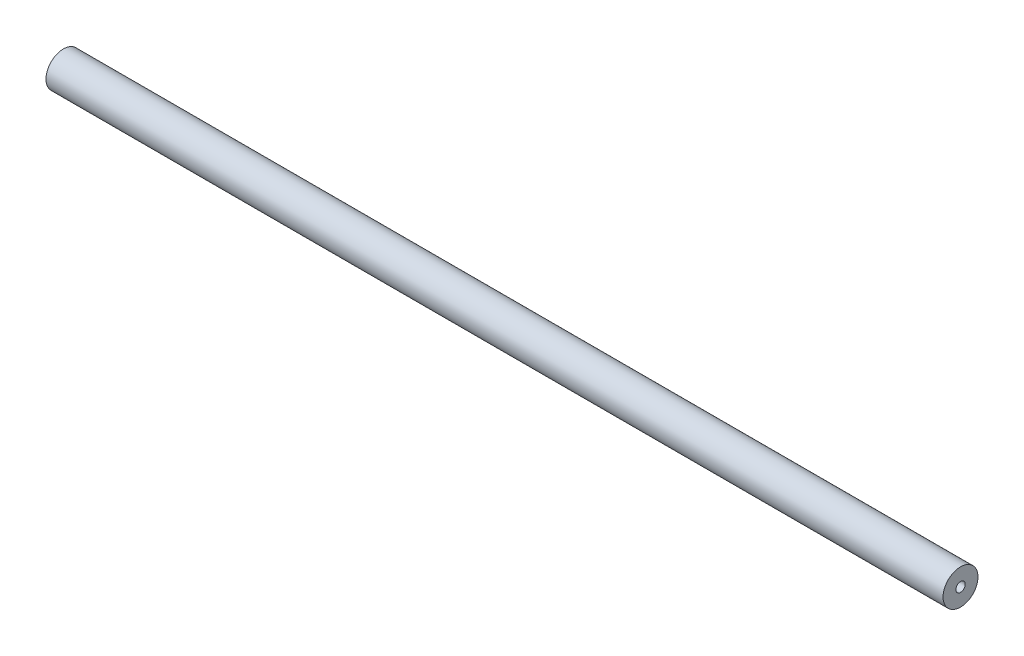
from build123d import *

# Parameters (mm, degrees)
SKETCH1_R                   = 9.525
BOSS_EXTRUDE1_DEPTH         = 488.95
F_1_4_20_TAPPED_HOLE1_D     = 5.1054
F_1_4_20_TAPPED_HOLE1_DEPTH = 16.51
F_1_4_20_TAPPED_HOLE1_TIP   = 1.533816902
F_1_4_20_TAPPED_HOLE2_D     = 5.1054
F_1_4_20_TAPPED_HOLE2_DEPTH = 16.51
F_1_4_20_TAPPED_HOLE2_TIP   = 1.533816902


with BuildPart() as part:
    # Sketch1 → Boss-Extrude1 (new body)
    with BuildSketch(Plane(origin=(0, 0, 0), x_dir=(0, 0, -1), z_dir=(1, 0, 0))):
        Circle(SKETCH1_R)
    extrude(amount=-BOSS_EXTRUDE1_DEPTH)

    # 1/4-20 Tapped Hole1
    with Locations(Plane(origin=(0, 0, 0), x_dir=(0, 0, -1), z_dir=(1, 0, 0))):
        with Locations((0, 0)):
            Hole(F_1_4_20_TAPPED_HOLE1_D / 2, depth=F_1_4_20_TAPPED_HOLE1_DEPTH)
            with Locations((0, 0, -(F_1_4_20_TAPPED_HOLE1_DEPTH + F_1_4_20_TAPPED_HOLE1_TIP / 2))):  # 118° drill point
                Cone(0, F_1_4_20_TAPPED_HOLE1_D / 2, F_1_4_20_TAPPED_HOLE1_TIP, mode=Mode.SUBTRACT)

    # 1/4-20 Tapped Hole2
    with Locations(Plane.ZY.offset(488.95)):
        with Locations((0, 0)):
            Hole(F_1_4_20_TAPPED_HOLE2_D / 2, depth=F_1_4_20_TAPPED_HOLE2_DEPTH)
            with Locations((0, 0, -(F_1_4_20_TAPPED_HOLE2_DEPTH + F_1_4_20_TAPPED_HOLE2_TIP / 2))):  # 118° drill point
                Cone(0, F_1_4_20_TAPPED_HOLE2_D / 2, F_1_4_20_TAPPED_HOLE2_TIP, mode=Mode.SUBTRACT)


solid = part.part
